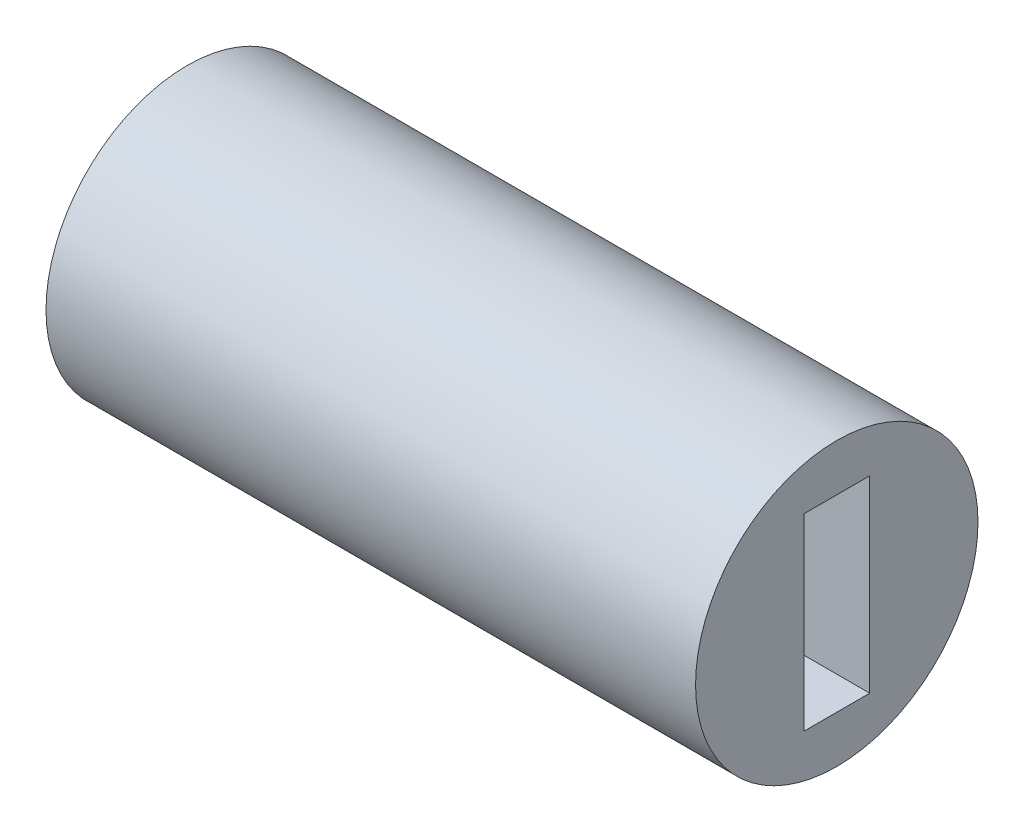
from build123d import *

# Parameters (mm, degrees)
SKETCH1_R           = 3
SKETCH1_W           = 1.4
SKETCH1_H           = 4
BOSS_EXTRUDE1_DEPTH = 10
BOSS_EXTRUDE2_START = 3.8
SKETCH2_R           = 3
SKETCH2_W           = 1.4
SKETCH2_H           = 5
BOSS_EXTRUDE2_DEPTH = 3.8


with BuildPart() as part:
    # Sketch1 → Boss-Extrude1 (new body)
    with BuildSketch(Plane(origin=(0, 0, 0), x_dir=(0, 0, -1), z_dir=(1, 0, 0))):
        Circle(SKETCH1_R)
        Rectangle(SKETCH1_W, SKETCH1_H, mode=Mode.SUBTRACT)
    extrude(amount=BOSS_EXTRUDE1_DEPTH)

    # Sketch2 → Boss-Extrude2 (add)
    with BuildSketch(Plane.ZY.offset(BOSS_EXTRUDE2_START)):
        Circle(SKETCH2_R)
        Rectangle(SKETCH2_W, SKETCH2_H, mode=Mode.SUBTRACT)
    extrude(amount=-BOSS_EXTRUDE2_DEPTH)


solid = part.part
